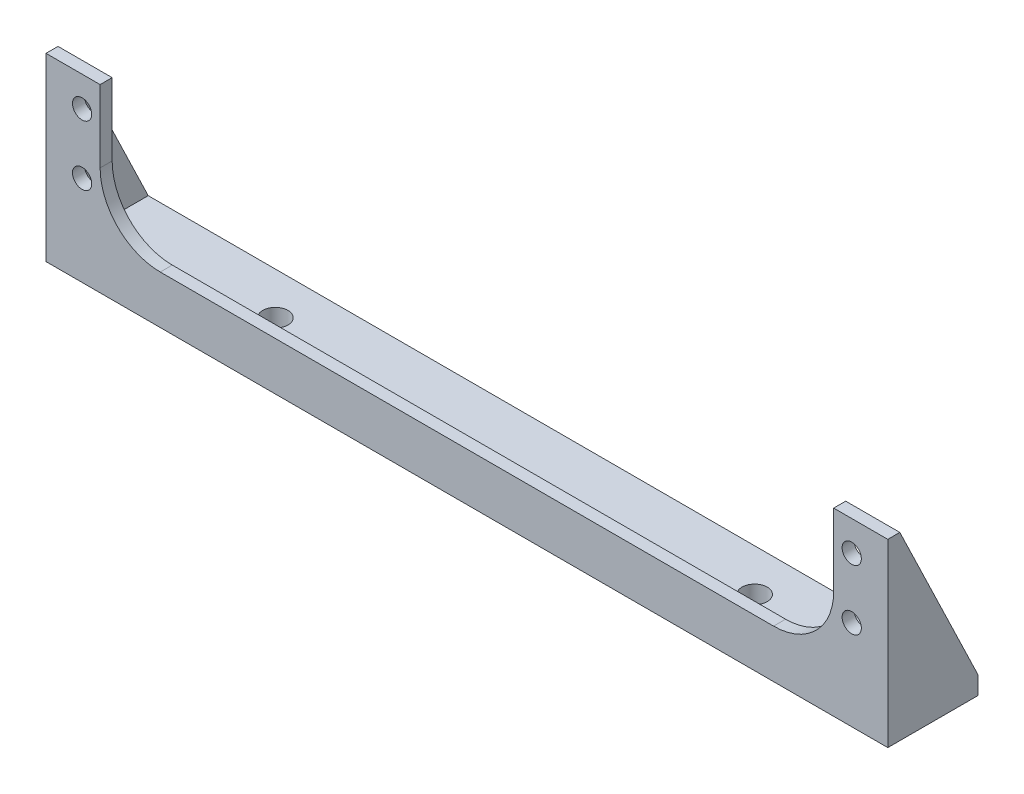
from build123d import *

# Parameters (mm, degrees)
SKETCH1_W           = 140
SKETCH1_H           = 15
BOSS_EXTRUDE1_DEPTH = 30
SKETCH2_W           = 122
SKETCH2_H           = 27
CUT_EXTRUDE1_DEPTH  = 30
SKETCH3_W           = 13
SKETCH3_H           = 27
CUT_EXTRUDE2_DEPTH  = 144.689142732
BOSS_EXTRUDE2_REACH = 119.876
SKETCH4_W           = 2
SKETCH4_H           = 13
CUT_EXTRUDE3_DEPTH  = 144.689142732
SKETCH6_R           = 1.6
CUT_EXTRUDE4_DEPTH  = 118.971522149
SKETCH7_R           = 2.1
CUT_EXTRUDE5_DEPTH  = 30
SKETCH8_W           = 122
SKETCH8_H           = 2
BOSS_EXTRUDE3_DEPTH = 5
FILLET3_R           = 10
FILLET4_R           = 2


with BuildPart() as part:
    # Sketch1 → Boss-Extrude1 (new body)
    with BuildSketch(Plane(origin=(0, 0, 0), x_dir=(1, 0, 0), z_dir=(0, 1, 0))):
        with Locations((-43.350253807, -4.606598985)):
            Rectangle(SKETCH1_W, SKETCH1_H)
    extrude(amount=BOSS_EXTRUDE1_DEPTH)

    # Sketch2 → Cut-Extrude1 (cut)
    with BuildSketch(Plane.XY.offset(12.106598985)):
        with Locations((-43.350253807, 16.5)):
            Rectangle(SKETCH2_W, SKETCH2_H)
    extrude(amount=-CUT_EXTRUDE1_DEPTH, mode=Mode.SUBTRACT)

    # Sketch3 → Cut-Extrude2 (cut, through all)
    with BuildSketch(Plane.ZY.offset(113.350253807)):
        with Locations((3.606598985, 16.5)):
            Rectangle(SKETCH3_W, SKETCH3_H)
    extrude(amount=-CUT_EXTRUDE2_DEPTH, mode=Mode.SUBTRACT)

    # Sketch4 → Boss-Extrude2 (add, up to next)
    with BuildSketch(Plane(origin=(0, 30, 0), x_dir=(1, 0, 0), z_dir=(0, 1, 0)), mode=Mode.PRIVATE) as boss_extrude2_sk1:
        with Locations((25.649746193, -3.606598985)):
            Rectangle(SKETCH4_W, SKETCH4_H)
    boss_extrude2_tool1 = extrude(boss_extrude2_sk1.sketch, amount=-BOSS_EXTRUDE2_REACH, mode=Mode.PRIVATE) - part.part
    # Sketch4 → Boss-Extrude2 (add, up to next)
    with BuildSketch(Plane(origin=(0, 30, 0), x_dir=(1, 0, 0), z_dir=(0, 1, 0)), mode=Mode.PRIVATE) as boss_extrude2_sk2:
        with Locations((-112.350253807, -3.606598985)):
            Rectangle(SKETCH4_W, SKETCH4_H)
    boss_extrude2_tool2 = extrude(boss_extrude2_sk2.sketch, amount=-BOSS_EXTRUDE2_REACH, mode=Mode.PRIVATE) - part.part
    add(boss_extrude2_tool1.solids().sort_by_distance((25.649746, 30, 3.606599))[0])
    add(boss_extrude2_tool2.solids().sort_by_distance((-112.350254, 30, 3.606599))[0])

    # Sketch5 → Cut-Extrude3 (cut, through all)
    with BuildSketch(Plane.ZY.offset(113.350253807)):
        Polygon((10.106598985, 30), (-2.893401015, 3), (-2.893401015, 30), align=None)
    extrude(amount=-CUT_EXTRUDE3_DEPTH, mode=Mode.SUBTRACT)

    # Sketch6 → Cut-Extrude4 (cut, through all)
    with BuildSketch(Plane(origin=(0, 0, 10.106598985), x_dir=(-1, 0, 0), z_dir=(0, 0, -1))):
        with Locations((-20.649746193, 25)):
            Circle(SKETCH6_R)
        with Locations((-20.649746193, 15)):
            Circle(SKETCH6_R)
        with Locations((107.350253807, 25)):
            Circle(SKETCH6_R)
        with Locations((107.350253807, 15)):
            Circle(SKETCH6_R)
    extrude(amount=-CUT_EXTRUDE4_DEPTH, mode=Mode.SUBTRACT)

    # Sketch7 → Cut-Extrude5 (cut)
    with BuildSketch(Plane(origin=(0, 3, 0), x_dir=(1, 0, 0), z_dir=(0, 1, 0))):
        with Locations(Location((-3.500253807, -4.106598985, 0), (0, 0, 270))):
            Circle(SKETCH7_R)
        with Locations(Location((-83.200253807, -4.106598985, 0), (0, 0, 270))):
            Circle(SKETCH7_R)
    extrude(amount=-CUT_EXTRUDE5_DEPTH, mode=Mode.SUBTRACT)

    # Sketch8 → Boss-Extrude3 (add)
    with BuildSketch(Plane(origin=(0, 3, 0), x_dir=(1, 0, 0), z_dir=(0, 1, 0))):
        with Locations((-43.350253807, -11.106598985)):
            Rectangle(SKETCH8_W, SKETCH8_H)
    extrude(amount=BOSS_EXTRUDE3_DEPTH)

    # Fillet3
    fillet3_edges = [part.edges().sort_by_distance(p)[0] for p in [
        (17.649746193, 8, 11.106598985),
        (-104.350253807, 8, 11.106598985),
    ]]
    fillet(fillet3_edges, radius=FILLET3_R)

    # Fillet4
    fillet4_edges = [part.edges().sort_by_distance(p)[0] for p in [
        (-43.350253807, 3, 10.106598985),
    ]]
    fillet(fillet4_edges, radius=FILLET4_R)


solid = part.part
